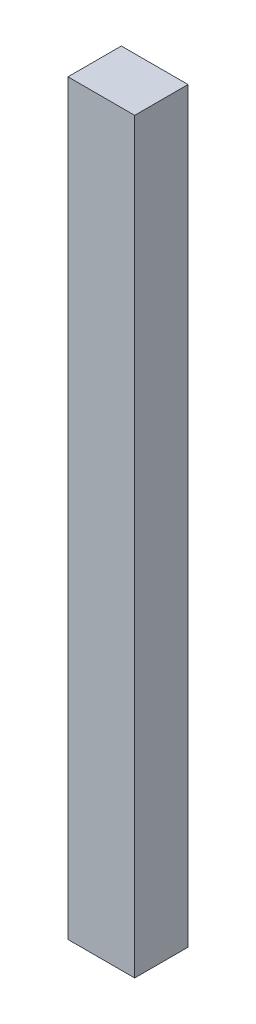
from build123d import *

# Parameters (mm, degrees)
SKETCH1_W                = 25
SKETCH1_H                = 20
FKAP_CERCEVE_SAG_1_DEPTH = 280


with BuildPart() as part:
    # Sketch1 → FKAP_cerceve_sag_1 (new body)
    with BuildSketch(Plane(origin=(0, 0, 0), x_dir=(1, 0, 0), z_dir=(0, 1, 0))):
        with Locations((627.5, -30)):
            Rectangle(SKETCH1_W, SKETCH1_H)
    extrude(amount=FKAP_CERCEVE_SAG_1_DEPTH)


solid = part.part
